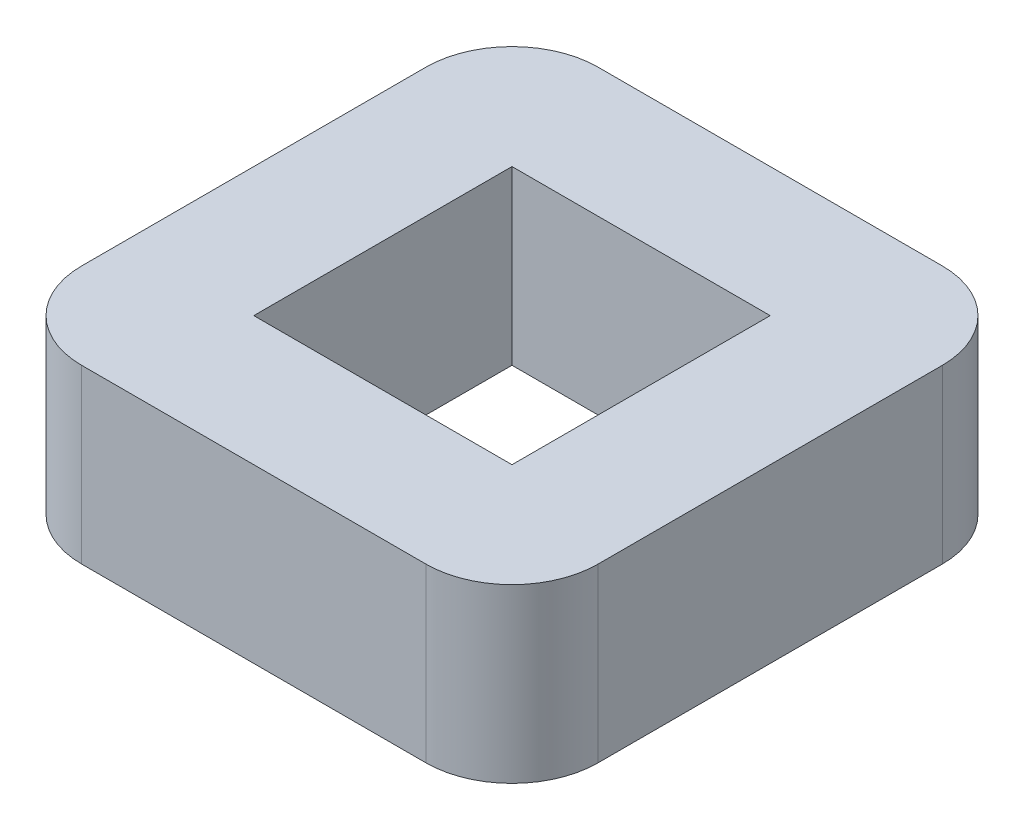
from build123d import *

# Parameters (mm, degrees)
SKETCH1_W           = 30
SKETCH1_H           = 30
BOSS_EXTRUDE1_DEPTH = 10


with BuildPart() as part:
    # Sketch1 → Boss-Extrude1 (new, symmetric)
    with BuildSketch(Plane(origin=(0, 0, 0), x_dir=(1, 0, 0), z_dir=(0, 1, 0))):
        with BuildLine():
            Line((-20, 30), (20, 30))
            ThreePointArc((20, 30), (27.071067812, 27.071067812), (30, 20))
            Line((30, 20), (30, -20))
            ThreePointArc((30, -20), (27.071067812, -27.071067812), (20, -30))
            Line((20, -30), (-20, -30))
            ThreePointArc((-20, -30), (-27.071067812, -27.071067812), (-30, -20))
            Line((-30, -20), (-30, 20))
            ThreePointArc((-30, 20), (-27.071067812, 27.071067812), (-20, 30))
        make_face()
        Rectangle(SKETCH1_W, SKETCH1_H, mode=Mode.SUBTRACT)
    extrude(amount=BOSS_EXTRUDE1_DEPTH, both=True)


solid = part.part
